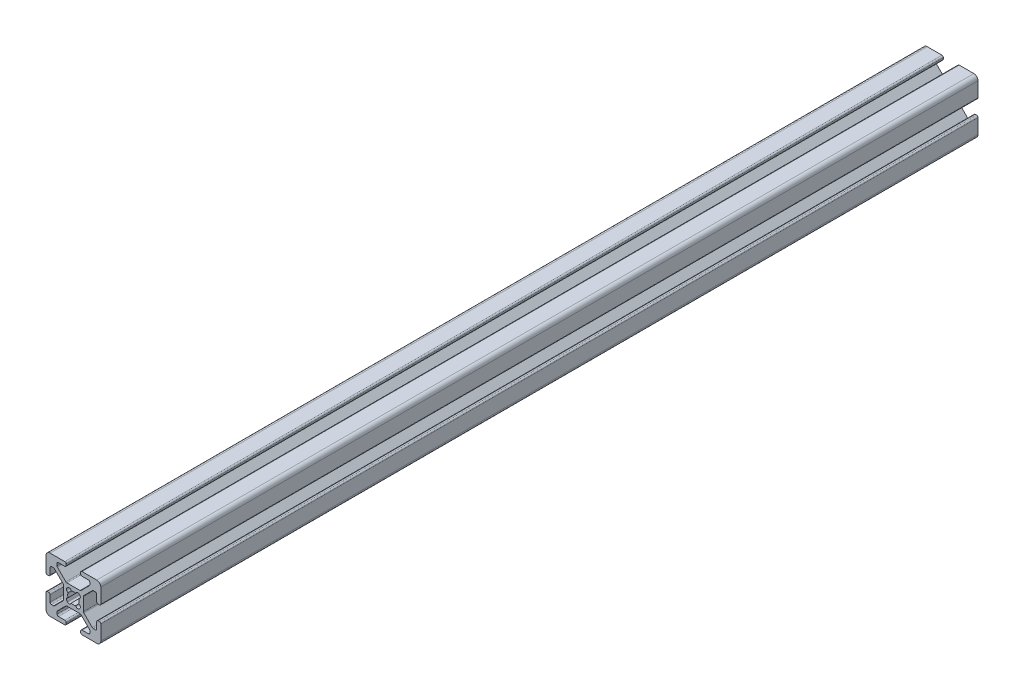
from build123d import *

# Parameters (mm, degrees)
BOSS_EXTRUDE1_DEPTH = 320


with BuildPart() as part:
    # Sketch1 → Boss-Extrude1 (new body)
    with BuildSketch(Plane.XY.offset(4000)):
        with BuildLine():
            Line((10, 3.138), (10, 8.5))
            ThreePointArc((10, 8.5), (9.560660172, 9.560660172), (8.5, 10))
            Line((8.5, 10), (3.138, 10))
            ThreePointArc((3.138, 10), (2.778789755, 9.851210245), (2.63, 9.492))
            Line((2.63, 9.492), (2.63, 9.008))
            ThreePointArc((2.63, 9.008), (2.778789755, 8.648789755), (3.138, 8.5))
            Line((3.138, 8.5), (5.487, 8.5))
            ThreePointArc((5.487, 8.5), (5.846210245, 8.351210245), (5.995, 7.992))
            Line((5.995, 7.992), (5.995, 7.266080661))
            ThreePointArc((5.995, 7.266080661), (5.956330803, 7.071677478), (5.846210245, 6.906870417))
            Line((5.846210245, 6.906870417), (2.743129583, 3.803789755))
            ThreePointArc((2.743129583, 3.803789755), (2.578322522, 3.693669197), (2.383919339, 3.655))
            Line((2.383919339, 3.655), (-2.383919339, 3.655))
            ThreePointArc((-2.383919339, 3.655), (-2.578322522, 3.693669197), (-2.743129583, 3.803789755))
            Line((-2.743129583, 3.803789755), (-5.846210245, 6.906870417))
            ThreePointArc((-5.846210245, 6.906870417), (-5.956330803, 7.071677478), (-5.995, 7.266080661))
            Line((-5.995, 7.266080661), (-5.995, 7.992))
            ThreePointArc((-5.995, 7.992), (-5.846210245, 8.351210245), (-5.487, 8.5))
            Line((-5.487, 8.5), (-3.138, 8.5))
            ThreePointArc((-3.138, 8.5), (-2.778789755, 8.648789755), (-2.63, 9.008))
            Line((-2.63, 9.008), (-2.63, 9.492))
            ThreePointArc((-2.63, 9.492), (-2.778789755, 9.851210245), (-3.138, 10))
            Line((-3.138, 10), (-8.5, 10))
            ThreePointArc((-8.5, 10), (-9.560660172, 9.560660172), (-10, 8.5))
            Line((-10, 8.5), (-10, 3.138))
            ThreePointArc((-10, 3.138), (-9.851210245, 2.778789755), (-9.492, 2.63))
            Line((-9.492, 2.63), (-9.008, 2.63))
            ThreePointArc((-9.008, 2.63), (-8.648789755, 2.778789755), (-8.5, 3.138))
            Line((-8.5, 3.138), (-8.5, 5.487))
            ThreePointArc((-8.5, 5.487), (-8.351210245, 5.846210245), (-7.992, 5.995))
            Line((-7.992, 5.995), (-7.266080661, 5.995))
            ThreePointArc((-7.266080661, 5.995), (-7.071677478, 5.956330803), (-6.906870417, 5.846210245))
            Line((-6.906870417, 5.846210245), (-3.803789755, 2.743129583))
            ThreePointArc((-3.803789755, 2.743129583), (-3.693669197, 2.578322522), (-3.655, 2.383919339))
            Line((-3.655, 2.383919339), (-3.655, -2.383919339))
            ThreePointArc((-3.655, -2.383919339), (-3.693669197, -2.578322522), (-3.803789755, -2.743129583))
            Line((-3.803789755, -2.743129583), (-6.906870417, -5.846210245))
            ThreePointArc((-6.906870417, -5.846210245), (-7.071677478, -5.956330803), (-7.266080661, -5.995))
            Line((-7.266080661, -5.995), (-7.992, -5.995))
            ThreePointArc((-7.992, -5.995), (-8.351210245, -5.846210245), (-8.5, -5.487))
            Line((-8.5, -5.487), (-8.5, -3.138))
            ThreePointArc((-8.5, -3.138), (-8.648789755, -2.778789755), (-9.008, -2.63))
            Line((-9.008, -2.63), (-9.492, -2.63))
            ThreePointArc((-9.492, -2.63), (-9.851210245, -2.778789755), (-10, -3.138))
            Line((-10, -3.138), (-10, -8.5))
            ThreePointArc((-10, -8.5), (-9.560660172, -9.560660172), (-8.5, -10))
            Line((-8.5, -10), (-3.138, -10))
            ThreePointArc((-3.138, -10), (-2.778789755, -9.851210245), (-2.63, -9.492))
            Line((-2.63, -9.492), (-2.63, -9.008))
            ThreePointArc((-2.63, -9.008), (-2.778789755, -8.648789755), (-3.138, -8.5))
            Line((-3.138, -8.5), (-5.487, -8.5))
            ThreePointArc((-5.487, -8.5), (-5.846210245, -8.351210245), (-5.995, -7.992))
            Line((-5.995, -7.992), (-5.995, -7.266080661))
            ThreePointArc((-5.995, -7.266080661), (-5.956330803, -7.071677478), (-5.846210245, -6.906870417))
            Line((-5.846210245, -6.906870417), (-2.743129583, -3.803789755))
            ThreePointArc((-2.743129583, -3.803789755), (-2.578322522, -3.693669197), (-2.383919339, -3.655))
            Line((-2.383919339, -3.655), (2.383919339, -3.655))
            ThreePointArc((2.383919339, -3.655), (2.578322522, -3.693669197), (2.743129583, -3.803789755))
            Line((2.743129583, -3.803789755), (5.846210245, -6.906870417))
            ThreePointArc((5.846210245, -6.906870417), (5.956330803, -7.071677478), (5.995, -7.266080661))
            Line((5.995, -7.266080661), (5.995, -7.992))
            ThreePointArc((5.995, -7.992), (5.846210245, -8.351210245), (5.487, -8.5))
            Line((5.487, -8.5), (3.138, -8.5))
            ThreePointArc((3.138, -8.5), (2.778789755, -8.648789755), (2.63, -9.008))
            Line((2.63, -9.008), (2.63, -9.492))
            ThreePointArc((2.63, -9.492), (2.778789755, -9.851210245), (3.138, -10))
            Line((3.138, -10), (8.5, -10))
            ThreePointArc((8.5, -10), (9.560660172, -9.560660172), (10, -8.5))
            Line((10, -8.5), (10, -3.138))
            ThreePointArc((10, -3.138), (9.851210245, -2.778789755), (9.492, -2.63))
            Line((9.492, -2.63), (9.008, -2.63))
            ThreePointArc((9.008, -2.63), (8.648789755, -2.778789755), (8.5, -3.138))
            Line((8.5, -3.138), (8.5, -5.487))
            ThreePointArc((8.5, -5.487), (8.351210245, -5.846210245), (7.992, -5.995))
            Line((7.992, -5.995), (7.266080661, -5.995))
            ThreePointArc((7.266080661, -5.995), (7.071677478, -5.956330803), (6.906870417, -5.846210245))
            Line((6.906870417, -5.846210245), (3.803789755, -2.743129583))
            ThreePointArc((3.803789755, -2.743129583), (3.693669197, -2.578322522), (3.655, -2.383919339))
            Line((3.655, -2.383919339), (3.655, 2.383919339))
            ThreePointArc((3.655, 2.383919339), (3.693669197, 2.578322522), (3.803789755, 2.743129583))
            Line((3.803789755, 2.743129583), (6.906870417, 5.846210245))
            ThreePointArc((6.906870417, 5.846210245), (7.071677478, 5.956330803), (7.266080661, 5.995))
            Line((7.266080661, 5.995), (7.992, 5.995))
            ThreePointArc((7.992, 5.995), (8.351210245, 5.846210245), (8.5, 5.487))
            Line((8.5, 5.487), (8.5, 3.138))
            ThreePointArc((8.5, 3.138), (8.648789755, 2.778789755), (9.008, 2.63))
            Line((9.008, 2.63), (9.492, 2.63))
            ThreePointArc((9.492, 2.63), (9.851210245, 2.778789755), (10, 3.138))
        make_face()
        with BuildLine():
            Line((-2.124900844, -2.304505966), (-2.304505966, -2.124900844))
            ThreePointArc((-2.304505966, -2.124900844), (-2.505938017, -1.356467811), (-1.935133506, -0.803976718))
            ThreePointArc((-1.935133506, -0.803976718), (-2.0955, 0), (-1.935133506, 0.803976718))
            ThreePointArc((-1.935133506, 0.803976718), (-2.505938017, 1.356467811), (-2.304505966, 2.124900844))
            Line((-2.304505966, 2.124900844), (-2.124900844, 2.304505966))
            ThreePointArc((-2.124900844, 2.304505966), (-1.356467811, 2.505938017), (-0.803976718, 1.935133506))
            ThreePointArc((-0.803976718, 1.935133506), (0, 2.0955), (0.803976718, 1.935133506))
            ThreePointArc((0.803976718, 1.935133506), (1.356467811, 2.505938017), (2.124900844, 2.304505966))
            Line((2.124900844, 2.304505966), (2.304505966, 2.124900844))
            ThreePointArc((2.304505966, 2.124900844), (2.505938017, 1.356467811), (1.935133506, 0.803976718))
            ThreePointArc((1.935133506, 0.803976718), (2.0955, 0), (1.935133506, -0.803976718))
            ThreePointArc((1.935133506, -0.803976718), (2.505938017, -1.356467811), (2.304505966, -2.124900844))
            Line((2.304505966, -2.124900844), (2.124900844, -2.304505966))
            ThreePointArc((2.124900844, -2.304505966), (1.356467811, -2.505938017), (0.803976718, -1.935133506))
            ThreePointArc((0.803976718, -1.935133506), (0, -2.0955), (-0.803976718, -1.935133506))
            ThreePointArc((-0.803976718, -1.935133506), (-1.356467811, -2.505938017), (-2.124900844, -2.304505966))
        make_face(mode=Mode.SUBTRACT)
    extrude(amount=-BOSS_EXTRUDE1_DEPTH)


solid = part.part
